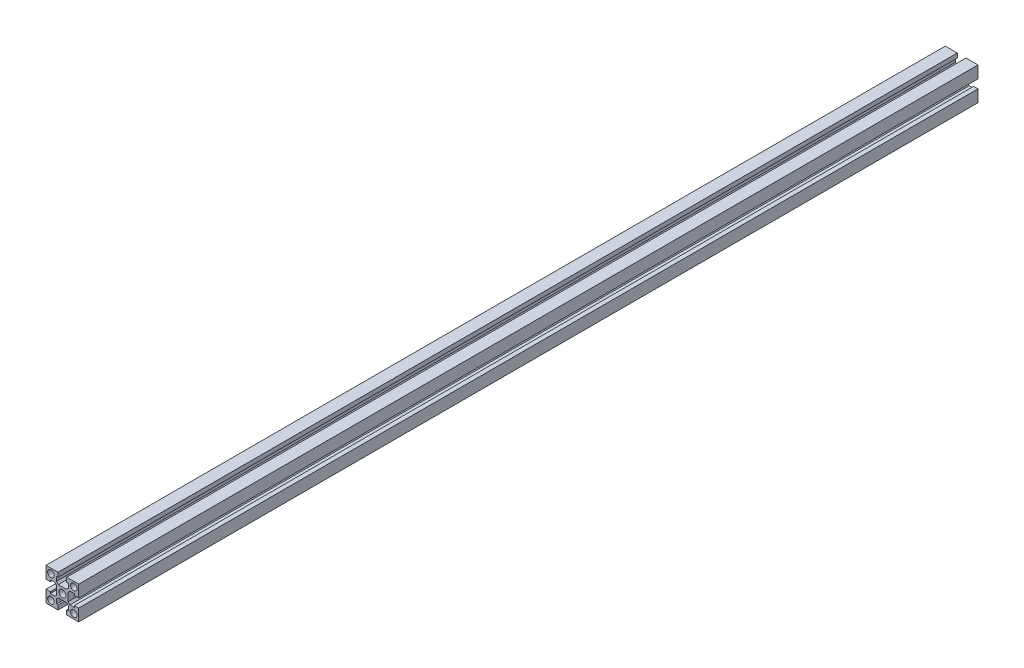
from build123d import *

# Parameters (mm, degrees)
SKETCH_1_R      = 2
SKETCH_1_R_2    = 2.15
EXTRUDE_1_DEPTH = 275


with BuildPart() as part:
    # 스케치1 → 보스-돌출1 (new, symmetric)
    with BuildSketch(Plane.XY):
        Polygon((-10, -10), (-2.65, -10), (-2.65, -7.35), (-3.65, -7.35), (-3.65, -4.639949494), (-2.510050506, -3.5), (0, -3.5), (2.510050506, -3.5), (3.65, -4.639949494), (3.65, -7.35), (2.65, -7.35), (2.65, -10), (10, -10), (10, -2.65), (7.35, -2.65), (7.35, -3.65), (4.639949494, -3.65), (3.5, -2.510050506), (3.5, 0), (3.5, 2.510050506), (4.639949494, 3.65), (7.35, 3.65), (7.35, 2.65), (10, 2.65), (10, 10), (2.65, 10), (2.65, 7.35), (3.65, 7.35), (3.65, 4.639949494), (2.510050506, 3.5), (0, 3.5), (-2.510050506, 3.5), (-3.65, 4.639949494), (-3.65, 7.35), (-2.65, 7.35), (-2.65, 10), (-10, 10), (-10, 2.65), (-7.35, 2.65), (-7.35, 3.65), (-4.639949494, 3.65), (-3.5, 2.510050506), (-3.5, 0), (-3.5, -2.510050506), (-4.639949494, -3.65), (-7.35, -3.65), (-7.35, -2.65), (-10, -2.65), align=None)
        with Locations((-7, 7)):
            Circle(SKETCH_1_R, mode=Mode.SUBTRACT)
        Circle(SKETCH_1_R_2, mode=Mode.SUBTRACT)
        with Locations((7, 7)):
            Circle(SKETCH_1_R, mode=Mode.SUBTRACT)
        with Locations((-7, -7)):
            Circle(SKETCH_1_R, mode=Mode.SUBTRACT)
        with Locations((7, -7)):
            Circle(SKETCH_1_R, mode=Mode.SUBTRACT)
    extrude(amount=EXTRUDE_1_DEPTH, both=True)


solid = part.part
